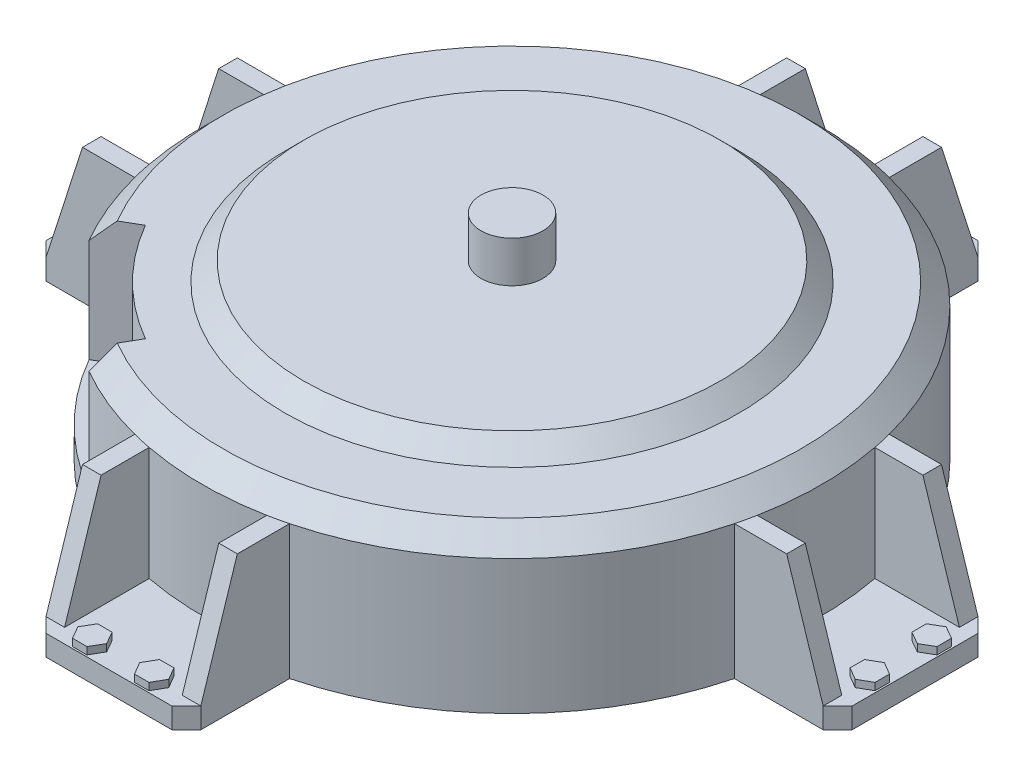
from build123d import *

# Parameters (mm, degrees)
SKETCH1_R                    = 150
BOSS_EXTRUDE1_DEPTH          = 75
CHAMFER1_SIZE                = 10
SKETCH3_W                    = 50
SKETCH3_H                    = 75
BOSS_EXTRUDE2_DEPTH          = 10
CHAMFER2_SIZE                = 7
BOSS_EXTRUDE5_DEPTH          = 9
BOSS_EXTRUDE6_DEPTH          = 3.5
CIRPATTERN1_COUNT            = 4
CIRPATTERN1_COPY_1_DEPTH     = 9
CIRPATTERN1_COPY_2_DEPTH     = 9
CIRPATTERN1_COPY_3_DEPTH     = 9
CIRPATTERN1_COPY_4_DEPTH     = 3.5
CIRPATTERN1_COPY_5_DEPTH     = 3.5
CIRPATTERN1_COPY_6_DEPTH     = 3.5
CHAMFER2_OF_CIRPATTERN1_SIZE = 7
CUT_EXTRUDE1_START           = -60
CUT_EXTRUDE1_DEPTH           = 60
SKETCH12_R                   = 110
BOSS_EXTRUDE7_DEPTH          = 9
BOSS_EXTRUDE7_TAPER          = 45
SKETCH13_R                   = 15
BOSS_EXTRUDE8_DEPTH          = 20


with BuildPart() as part:
    # Sketch1 → Boss-Extrude1 (new body)
    with BuildSketch(Plane(origin=(0, 0, 0), x_dir=(1, 0, 0), z_dir=(0, 1, 0))):
        with Locations(Location((0, 0, 0), (0, 0, 270))):
            Circle(SKETCH1_R)
    extrude(amount=BOSS_EXTRUDE1_DEPTH)

    # Chamfer1
    chamfer1_edges = [part.edges().sort_by_distance(p)[0] for p in [
        (0, 75, -150),
    ]]
    chamfer(chamfer1_edges, length=CHAMFER1_SIZE)

    # Sketch3 → Boss-Extrude2 (add)
    with BuildSketch(Plane.XZ):
        with Locations((-170.236875483, 0)):
            Rectangle(SKETCH3_W, SKETCH3_H)
    boss_extrude2 = extrude(amount=-BOSS_EXTRUDE2_DEPTH)

    # Chamfer2
    chamfer2_edges = [part.edges().sort_by_distance(p)[0] for p in [
        (-195.236875483, 5, -37.5),
        (-195.236875483, 5, 37.5),
    ]]
    chamfer(chamfer2_edges, length=CHAMFER2_SIZE)

    # Sketch9 → Boss-Extrude5 (add)
    with BuildSketch(Plane.XY.offset(37.5)):
        Polygon((-145.236875483, 10), (-145.236875483, 65), (-170.556875483, 65), (-188.236875483, 10), align=None)
    boss_extrude5 = extrude(amount=-BOSS_EXTRUDE5_DEPTH)

    # Sketch10 → Boss-Extrude6 (add)
    with BuildSketch(Plane(origin=(0, 10, 0), x_dir=(1, 0, 0), z_dir=(0, 1, 0))):
        Polygon((-188.273404849, -22.007550003), (-182.224586751, -18.469737626), (-182.264013094, -11.462401302), (-188.352257535, -7.992877354), (-194.401075633, -11.53068973), (-194.361649291, -18.538026055), align=None)
    boss_extrude6 = extrude(amount=BOSS_EXTRUDE6_DEPTH)

    # Mirror1: Boss-Extrude5, Boss-Extrude6 across plane
    add(boss_extrude5.mirror(Plane.XY))
    add(boss_extrude6.mirror(Plane.XY))

    # CirPattern1: Boss-Extrude2, Boss-Extrude5, Boss-Extrude6 ×4 about axis
    cirpattern1_axis = Axis((0, 0, 0), (0, 1, 0))
    add([boss_extrude2.rotate(cirpattern1_axis, i * 360 / CIRPATTERN1_COUNT) for i in range(1, CIRPATTERN1_COUNT)])
    add([boss_extrude5.rotate(cirpattern1_axis, i * 360 / CIRPATTERN1_COUNT) for i in range(1, CIRPATTERN1_COUNT)])
    add([boss_extrude6.rotate(cirpattern1_axis, i * 360 / CIRPATTERN1_COUNT) for i in range(1, CIRPATTERN1_COUNT)])

    # CirPattern1 copy 1 sketch → CirPattern1 copy 1 (add)
    with BuildSketch(Plane(origin=(-37.5, 0, 0), x_dir=(0, 0, -1), z_dir=(-1, 0, 0))):
        Polygon((-145.236875483, -10), (-145.236875483, -65), (-170.556875483, -65), (-188.236875483, -10), align=None)
    extrude(amount=-CIRPATTERN1_COPY_1_DEPTH)

    # CirPattern1 copy 2 sketch → CirPattern1 copy 2 (add)
    with BuildSketch(Plane(origin=(0, 0, 37.5), x_dir=(-1, 0, 0), z_dir=(0, 0, 1))):
        Polygon((-145.236875483, -10), (-145.236875483, -65), (-170.556875483, -65), (-188.236875483, -10), align=None)
    extrude(amount=-CIRPATTERN1_COPY_2_DEPTH)

    # CirPattern1 copy 3 sketch → CirPattern1 copy 3 (add)
    with BuildSketch(Plane(origin=(37.5, 0, 0), x_dir=(0, 0, 1), z_dir=(1, 0, 0))):
        Polygon((-145.236875483, -10), (-145.236875483, -65), (-170.556875483, -65), (-188.236875483, -10), align=None)
    extrude(amount=-CIRPATTERN1_COPY_3_DEPTH)

    # CirPattern1 copy 4 sketch → CirPattern1 copy 4 (add)
    with BuildSketch(Plane(origin=(0, 10, 0), x_dir=(0, 0, -1), z_dir=(0, 1, 0))):
        Polygon((-188.273404849, 22.007550003), (-182.224586751, 18.469737626), (-182.264013094, 11.462401302), (-188.352257535, 7.992877354), (-194.401075633, 11.53068973), (-194.361649291, 18.538026055), align=None)
    extrude(amount=CIRPATTERN1_COPY_4_DEPTH)

    # CirPattern1 copy 5 sketch → CirPattern1 copy 5 (add)
    with BuildSketch(Plane(origin=(0, 10, 0), x_dir=(-1, 0, 0), z_dir=(0, 1, 0))):
        Polygon((-188.273404849, 22.007550003), (-182.224586751, 18.469737626), (-182.264013094, 11.462401302), (-188.352257535, 7.992877354), (-194.401075633, 11.53068973), (-194.361649291, 18.538026055), align=None)
    extrude(amount=CIRPATTERN1_COPY_5_DEPTH)

    # CirPattern1 copy 6 sketch → CirPattern1 copy 6 (add)
    with BuildSketch(Plane.ZX.offset(10)):
        Polygon((-188.273404849, 22.007550003), (-182.224586751, 18.469737626), (-182.264013094, 11.462401302), (-188.352257535, 7.992877354), (-194.401075633, 11.53068973), (-194.361649291, 18.538026055), align=None)
    extrude(amount=CIRPATTERN1_COPY_6_DEPTH)

    # Chamfer2 of CirPattern1
    chamfer2_of_cirpattern1_edges = [part.edges().sort_by_distance(p)[0] for p in [
        (-37.5, 5, 195.236875483),
        (37.5, 5, 195.236875483),
        (195.236875483, 5, 37.5),
        (195.236875483, 5, -37.5),
        (37.5, 5, -195.236875483),
        (-37.5, 5, -195.236875483),
    ]]
    chamfer(chamfer2_of_cirpattern1_edges, length=CHAMFER2_OF_CIRPATTERN1_SIZE)

    # Sketch11 → Cut-Extrude1 (cut)
    with BuildSketch(Plane(origin=(0, 75, 0), x_dir=(1, 0, 0), z_dir=(0, 1, 0)).offset(CUT_EXTRUDE1_START)):
        with BuildLine():
            Line((-112.583302492, -65), (-129.903810568, -75))
            ThreePointArc((-129.903810568, -75), (-106.066017178, -106.066017178), (-75, -129.903810568))
            Line((-75, -129.903810568), (-65, -112.583302492))
            ThreePointArc((-65, -112.583302492), (-91.923881554, -91.923881554), (-112.583302492, -65))
        make_face()
    extrude(amount=CUT_EXTRUDE1_DEPTH, mode=Mode.SUBTRACT)

    # Sketch12 → Boss-Extrude7 (add)
    with BuildSketch(Plane(origin=(0, 75, 0), x_dir=(1, 0, 0), z_dir=(0, 1, 0))):
        Circle(SKETCH12_R)
    extrude(amount=BOSS_EXTRUDE7_DEPTH, taper=BOSS_EXTRUDE7_TAPER)

    # Sketch13 → Boss-Extrude8 (add)
    with BuildSketch(Plane(origin=(0, 84, 0), x_dir=(1, 0, 0), z_dir=(0, 1, 0))):
        with Locations(Location((0, 0, 0), (0, 0, 270))):
            Circle(SKETCH13_R)
    extrude(amount=BOSS_EXTRUDE8_DEPTH)


solid = part.part
